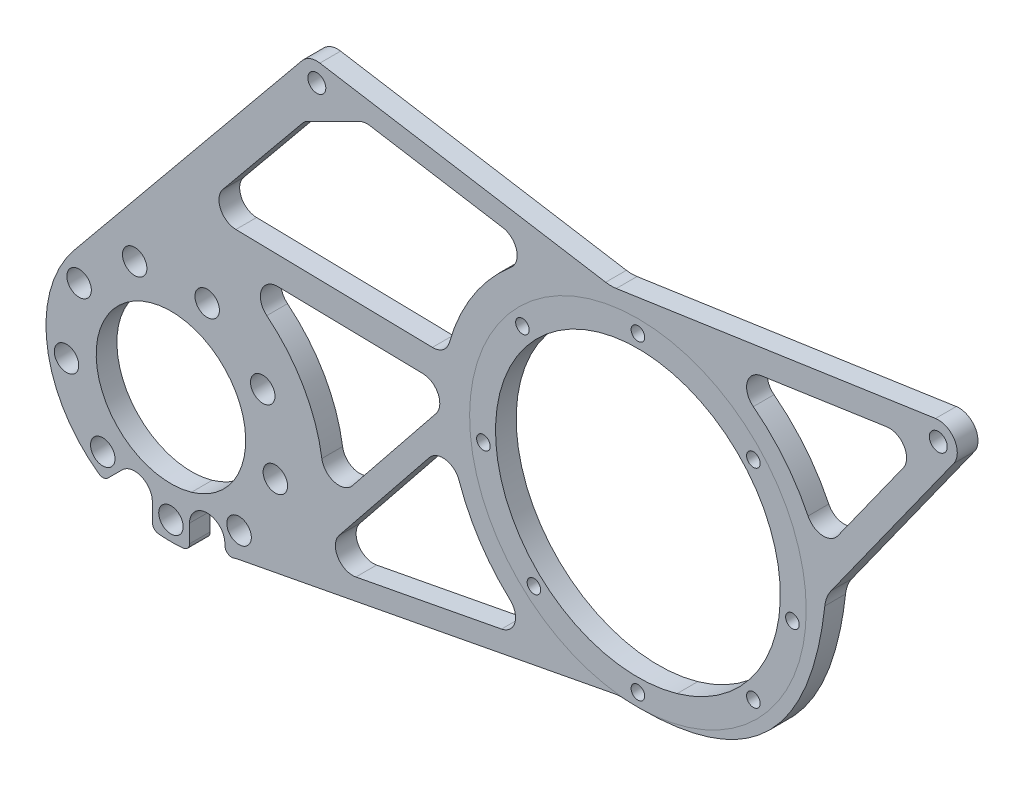
from build123d import *

# Parameters (mm, degrees)
SKETCH15_R          = 4.5
SKETCH15_R_2        = 27.4955
SKETCH15_R_3        = 2.5
SKETCH15_R_4        = 52.3875
SKETCH15_R_5        = 3.3
BOSS_EXTRUDE1_DEPTH = 7.62
PROFILE_DEPTH       = 804.110776731
PROF_FILLET_R       = 12.7
CUT_EXTRUDE2_DEPTH  = 804.110776731
FILLET2_R           = 6.35
CUT_EXTRUDE4_DEPTH  = 804.110776731
FILLET5_R           = 6.35
CUT_EXTRUDE8_DEPTH  = 804.110776731
FILLET6_R           = 12.7


with BuildPart() as part:
    # Sketch15 → Boss-Extrude1 (new body)
    with BuildSketch(Plane(origin=(0, 0, 0), x_dir=(-1, 0, 0), z_dir=(0, 0, 1))):
        with BuildLine():
            ThreePointArc((-468.520845097, 164.597881552), (-470.201009111, 165.051242365), (-471.778645707, 164.316701751))
            Line((-471.778645707, 164.316701751), (-477.043529325, 159.051818133))
            ThreePointArc((-477.043529325, 159.051818133), (-484.127165713, 157.642795249), (-488.139723403, 163.648012211))
            Line((-488.139723403, 163.648012211), (-488.139723403, 170.220745001))
            ThreePointArc((-488.139723403, 170.220745001), (-488.796888696, 171.925600851), (-490.428332433, 172.748273949))
            ThreePointArc((-490.428332433, 172.748273949), (-494.978508993, 172.974), (-499.528685552, 172.748273949))
            ThreePointArc((-499.528685552, 172.748273949), (-501.160129289, 171.925600851), (-501.817294582, 170.220745001))
            Line((-501.817294582, 170.220745001), (-501.817294582, 163.648012211))
            ThreePointArc((-501.817294582, 163.648012211), (-508.317294582, 157.148012211), (-514.817294582, 163.648012211))
            Line((-514.817294582, 163.648012211), (-514.817294582, 164.225022653))
            ThreePointArc((-514.817294582, 164.225022653), (-516.106794745, 166.435870942), (-518.665995494, 166.401924563))
            Line((-518.665995494, 166.401924563), (-660.126842441, 139.458698233))
            Line((-660.126842441, 139.458698233), (-776.492771968, 151.978917225))
            ThreePointArc((-776.492771968, 151.978917225), (-781.907485254, 150.230614898), (-784.225, 145.034))
            Line((-784.225, 145.034), (-784.225, 0))
            ThreePointArc((-784.225, 0), (-782.179140867, -4.939140867), (-777.24, -6.985))
            Line((-777.24, -6.985), (-548.64, -6.985))
            ThreePointArc((-548.64, -6.985), (-545.651186694, -6.313257481), (-543.237237519, -4.427231931))
            Line((-543.237237519, -4.427231931), (-459.418508663, 97.860764379))
            ThreePointArc((-459.418508663, 97.860764379), (-449.426249212, 133.212914363), (-468.520845097, 164.597881552))
        make_face()
        with Locations((-508.317294582, 90.351987789)):
            Circle(SKETCH15_R, mode=Mode.SUBTRACT)
        with Locations((-481.639723403, 90.351987789)):
            Circle(SKETCH15_R, mode=Mode.SUBTRACT)
        with Locations((-528.75349974, 107.5)):
            Circle(SKETCH15_R, mode=Mode.SUBTRACT)
        with Locations((-461.203518245, 107.5)):
            Circle(SKETCH15_R, mode=Mode.SUBTRACT)
        with Locations((-533.38601136, 133.772278929)):
            Circle(SKETCH15_R, mode=Mode.SUBTRACT)
        with Locations((-494.978508993, 127)):
            Circle(SKETCH15_R_2, mode=Mode.SUBTRACT)
        with Locations((-456.571006625, 133.772278929)):
            Circle(SKETCH15_R, mode=Mode.SUBTRACT)
        with Locations((-520.04722577, 156.875733282)):
            Circle(SKETCH15_R, mode=Mode.SUBTRACT)
        with Locations((-494.978508993, 166)):
            Circle(SKETCH15_R, mode=Mode.SUBTRACT)
        with Locations((-469.909792215, 156.875733282)):
            Circle(SKETCH15_R, mode=Mode.SUBTRACT)
        with Locations((-609.91307368, 83.875279047)):
            Circle(SKETCH15_R_3, mode=Mode.SUBTRACT)
        with Locations((-666.75, 135.051477371)):
            Circle(SKETCH15_R_3, mode=Mode.SUBTRACT)
        with Locations((-666.75, 20.751477371)):
            Circle(SKETCH15_R_3, mode=Mode.SUBTRACT)
        with Locations((-709.220726776, 39.660663218)):
            Circle(SKETCH15_R_3, mode=Mode.SUBTRACT)
        with Locations((-624.279273224, 39.660663218)):
            Circle(SKETCH15_R_3, mode=Mode.SUBTRACT)
        with Locations((-666.75, 77.901477371)):
            Circle(SKETCH15_R_4, mode=Mode.SUBTRACT)
        with Locations((-723.58692632, 83.875279047)):
            Circle(SKETCH15_R_3, mode=Mode.SUBTRACT)
        with Locations((-709.220726776, 116.142291524)):
            Circle(SKETCH15_R_3, mode=Mode.SUBTRACT)
        with Locations((-628.509185847, 120.372204147)):
            Circle(SKETCH15_R_3, mode=Mode.SUBTRACT)
        with Locations((-548.64, 0)):
            Circle(SKETCH15_R_5, mode=Mode.SUBTRACT)
        with Locations((-777.24, 0)):
            Circle(SKETCH15_R_5, mode=Mode.SUBTRACT)
        with Locations((-777.24, 145.034)):
            Circle(SKETCH15_R_5, mode=Mode.SUBTRACT)
    extrude(amount=BOSS_EXTRUDE1_DEPTH)

    # Sketch18 → Profile (cut, through all)
    with BuildSketch(Plane.XY.offset(7.62)):
        with BuildLine():
            Line((656.843849148, -10.682497906), (776.22161066, 6.910362375))
            ThreePointArc((776.22161066, 6.910362375), (776.729439616, 6.966315604), (777.24, 6.985))
            Line((777.24, 6.985), (548.64, 6.985))
            ThreePointArc((548.64, 6.985), (549.207578223, 6.961902036), (549.771402717, 6.892760905))
            Line((549.771402717, 6.892760905), (656.843849148, -10.682497906))
        make_face()
        with BuildLine():
            Line((735.827075043, -69.956273799), (783.061059407, -141.173236814))
            ThreePointArc((783.061059407, -141.173236814), (783.927687379, -143.01779998), (784.225, -145.034))
            Line((784.225, -145.034), (784.225, 0))
            ThreePointArc((784.225, 0), (783.891483704, -2.132601588), (782.922783957, -4.061550382))
            Line((782.922783957, -4.061550382), (735.827075043, -69.956273799))
        make_face()
    extrude(amount=-PROFILE_DEPTH, mode=Mode.SUBTRACT)

    # Prof Fillet
    prof_fillet_edges = [part.edges().sort_by_distance(p)[0] for p in [
        (660.126842441, -139.458698233, 3.81),
        (656.843849148, -10.682497906, 3.81),
    ]]
    fillet(prof_fillet_edges, radius=PROF_FILLET_R)

    # Sketch19 → Cut-Extrude2 (cut, through all)
    with BuildSketch(Plane.XY.offset(7.62)):
        with BuildLine():
            ThreePointArc((694.45302227, -14.12600314), (718.789944466, -31.786265822), (733.394654999, -58.070730629))
            Line((733.394654999, -58.070730629), (773.084551456, -2.537969581))
            Line((773.084551456, -2.537969581), (694.45302227, -14.12600314))
        make_face()
        with BuildLine():
            Line((772.681244896, -143.90484261), (735.555674658, -87.928824534))
            ThreePointArc((735.555674658, -87.928824534), (725.141244771, -115.65371029), (704.133403657, -136.529539656))
            Line((704.133403657, -136.529539656), (772.681244896, -143.90484261))
        make_face()
    extrude(amount=-CUT_EXTRUDE2_DEPTH, mode=Mode.SUBTRACT)

    # Fillet2
    fillet2_edges = [part.edges().sort_by_distance(p)[0] for p in [
        (694.45302227, -14.12600314, 3.81),
        (773.084551456, -2.537969581, 3.81),
        (733.394654999, -58.070730629, 3.81),
        (772.681244896, -143.90484261, 3.81),
        (704.133403657, -136.529539656, 3.81),
        (735.555674658, -87.928824534, 3.81),
    ]]
    fillet(fillet2_edges, radius=FILLET2_R)

    # Sketch22 → Cut-Extrude4 (cut, through all)
    with BuildSketch(Plane.XY.offset(7.62)):
        with BuildLine():
            Line((544.206709687, -14.426912925), (505.79558687, -61.301839836))
            Line((505.79558687, -61.301839836), (596.214449629, -63.096701449))
            ThreePointArc((596.214449629, -63.096701449), (609.03222208, -34.737796246), (632.611679529, -14.426912925))
            Line((632.611679529, -14.426912925), (566.137854436, -3.515658731))
            Line((566.137854436, -3.515658731), (544.206709687, -14.426912925))
        make_face()
        with BuildLine():
            Line((546.092983647, -153.421082711), (630.634467741, -137.318957004))
            ThreePointArc((630.634467741, -137.318957004), (608.965754764, -116.576398946), (598.051124974, -88.636146739))
            Line((598.051124974, -88.636146739), (546.092983647, -153.421082711))
        make_face()
        with BuildLine():
            Line((600.547071221, -73.344707791), (502.723422183, -71.402857307))
            ThreePointArc((502.723422183, -71.402857307), (540.105814597, -93.615089563), (550.408802524, -135.86050309))
            Line((550.408802524, -135.86050309), (600.547071221, -73.344707791))
        make_face()
    extrude(amount=-CUT_EXTRUDE4_DEPTH, mode=Mode.SUBTRACT)

    # Fillet5
    fillet5_edges = [part.edges().sort_by_distance(p)[0] for p in [
        (630.634467741, -137.318957004, 3.81),
        (546.092983647, -153.421082711, 3.81),
        (598.051124974, -88.636146739, 3.81),
        (550.408802524, -135.86050309, 3.81),
        (600.547071221, -73.344707791, 3.81),
        (502.723422183, -71.402857307, 3.81),
        (596.214449629, -63.096701449, 3.81),
        (505.79558687, -61.301839836, 3.81),
        (632.611679529, -14.426912925, 3.81),
        (566.137854436, -3.515658731, 3.81),
        (544.206709687, -14.426912925, 3.81),
    ]]
    fillet(fillet5_edges, radius=FILLET5_R)

    # Sketch26 → Cut-Extrude8 (cut, through all)
    with BuildSketch(Plane.XY.offset(7.62)):
        with BuildLine():
            Line((783.061059407, -141.173236814), (735.827075043, -69.956273799))
            add(Edge.make_bspline(
                [(662.00549252, -139.660828792), (729.199735591, -143.098901444), (735.827075043, -69.956273799)],
                knots=[0, 0, 0, 1, 1, 1], degree=2))
            Line((662.00549252, -139.660828792), (776.492771968, -151.978917225))
            ThreePointArc((776.492771968, -151.978917225), (783.208804193, -148.662167789), (783.061059407, -141.173236814))
        make_face()
    extrude(amount=-CUT_EXTRUDE8_DEPTH, mode=Mode.SUBTRACT)

    # Fillet6
    fillet6_edges = [part.edges().sort_by_distance(p)[0] for p in [
        (735.827075043, -69.956273799, 3.81),
    ]]
    fillet(fillet6_edges, radius=FILLET6_R)


solid = part.part
